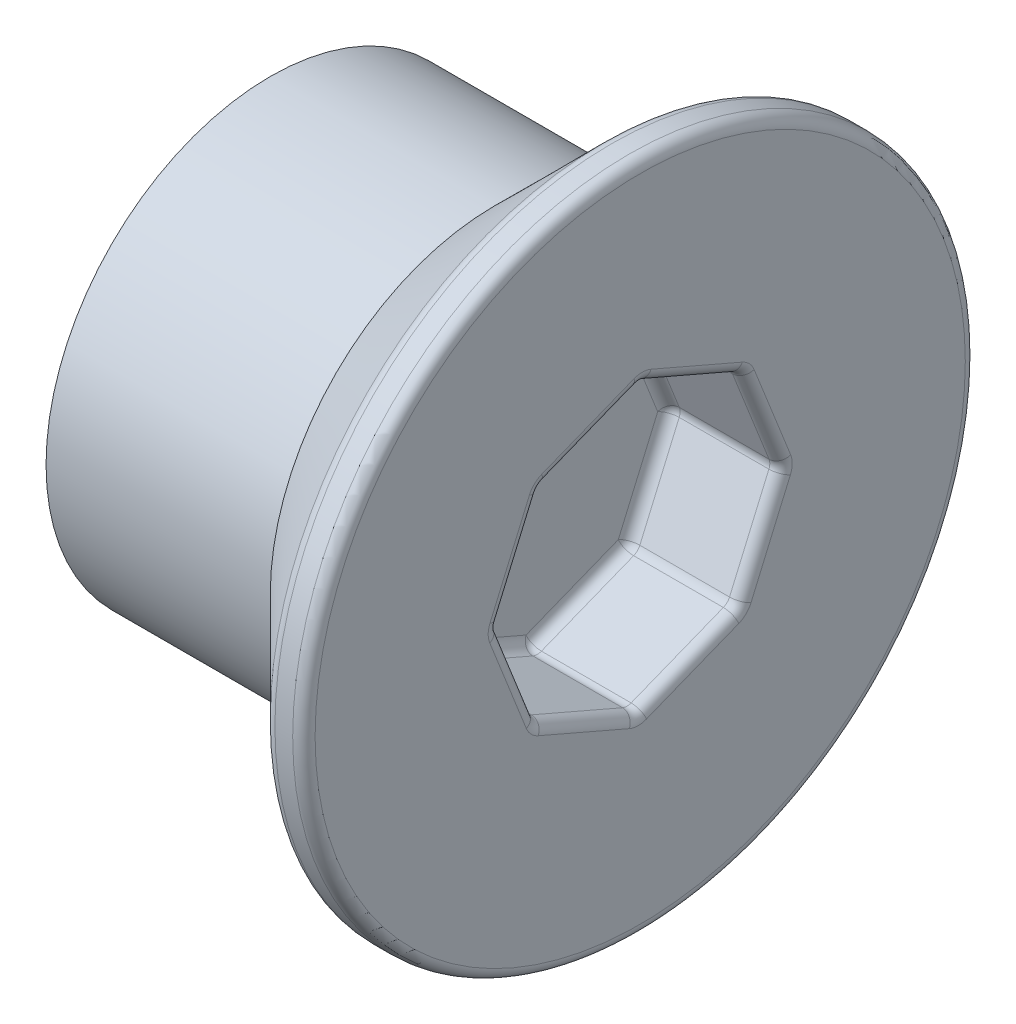
from build123d import *

# Parameters (mm, degrees)
SKETCH1_R           = 3
BOSS_EXTRUDE1_DEPTH = 1.3
CHAMFER1_SIZE       = 1
SKETCH2_R           = 2
BOSS_EXTRUDE2_DEPTH = 2
CUT_EXTRUDE3_DEPTH  = 1
FILLET1_R           = 0.1
FILLET2_R           = 0.1


with BuildPart() as part:
    # Sketch1 → Boss-Extrude1 (new body)
    with BuildSketch(Plane(origin=(0, 0, 0), x_dir=(0, 0, -1), z_dir=(1, 0, 0))):
        Circle(SKETCH1_R)
    extrude(amount=BOSS_EXTRUDE1_DEPTH)

    # Chamfer1
    chamfer1_edges = [part.edges().sort_by_distance(p)[0] for p in [
        (0, 0, 3),
    ]]
    chamfer(chamfer1_edges, length=CHAMFER1_SIZE)

    # Sketch2 → Boss-Extrude2 (add)
    with BuildSketch(Plane.ZY):
        with Locations(Location((0, 0, 0), (0, 0, 180))):
            Circle(SKETCH2_R)
    extrude(amount=BOSS_EXTRUDE2_DEPTH)

    # Sketch4 → Cut-Extrude3 (cut)
    with BuildSketch(Plane(origin=(1.3, 0, 0), x_dir=(0, 0, -1), z_dir=(1, 0, 0))):
        Polygon((0.880205355, -0.907790138), (1.264303737, -0.019505387), (0.907790138, 0.880205355), (0.019505387, 1.264303737), (-0.880205355, 0.907790138), (-1.264303737, 0.019505387), (-0.907790138, -0.880205355), (-0.019505387, -1.264303737), align=None)
    extrude(amount=-CUT_EXTRUDE3_DEPTH, mode=Mode.SUBTRACT)

    # Fillet1
    fillet1_edges = [part.edges().sort_by_distance(p)[0] for p in [
        (0.3, -0.463647763, -1.072254546),
        (0.8, -0.019505387, -1.264303737),
        (0.3, -1.086046938, -0.430349984),
        (0.8, -0.907790138, -0.880205355),
        (0.3, -1.072254546, 0.463647763),
        (0.8, -1.264303737, 0.019505387),
        (0.3, -0.430349984, 1.086046938),
        (0.8, -0.880205355, 0.907790138),
        (0.3, 0.463647763, 1.072254546),
        (0.8, 0.019505387, 1.264303737),
        (0.3, 1.086046938, 0.430349984),
        (0.8, 0.907790138, 0.880205355),
        (0.3, 1.072254546, -0.463647763),
        (0.8, 1.264303737, -0.019505387),
        (0.3, 0.430349984, -1.086046938),
        (0.8, 0.880205355, -0.907790138),
        (1.3, -0.463647763, -1.072254546),
        (1.3, 0.430349984, -1.086046938),
        (1.3, 1.072254546, -0.463647763),
        (1.3, 1.086046938, 0.430349984),
        (1.3, 0.463647763, 1.072254546),
        (1.3, -0.430349984, 1.086046938),
        (1.3, -1.072254546, 0.463647763),
        (1.3, -1.086046938, -0.430349984),
    ]]
    fillet(fillet1_edges, radius=FILLET1_R)

    # Fillet2
    fillet2_edges = [part.edges().sort_by_distance(p)[0] for p in [
        (1.3, 0, 3),
        (1, 0, 3),
    ]]
    fillet(fillet2_edges, radius=FILLET2_R)


solid = part.part
